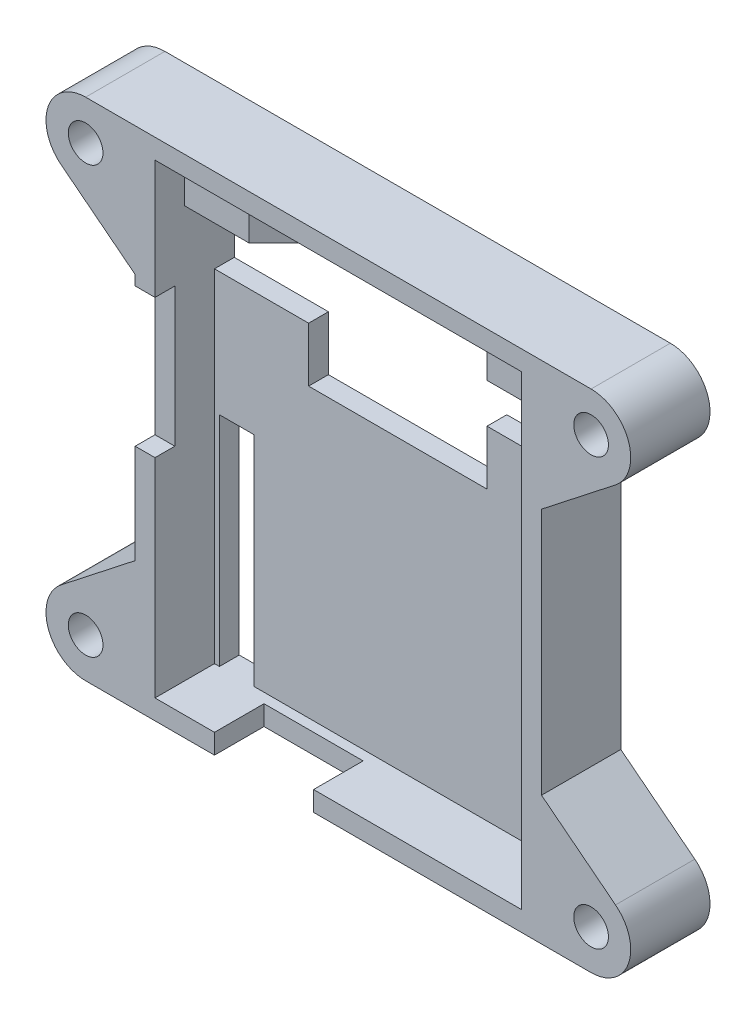
from build123d import *

# Parameters (mm, degrees)
SKETCH1_W                                  = 41
SKETCH1_H                                  = 51
BOSS_EXTRUDE1_DEPTH                        = 8
SHELL1_T                                   = -2
CUT_EXTRUDE1_DEPTH                         = 34.264094757
SKETCH3_W                                  = 10
SKETCH3_H                                  = 5
CUT_EXTRUDE2_DEPTH                         = 7
SKETCH4_W                                  = 2
SKETCH4_H                                  = 14
CUT_EXTRUDE3_DEPTH                         = 7
SKETCH5_W                                  = 3.5
SKETCH5_H                                  = 22
CUT_EXTRUDE4_DEPTH                         = 7
SKETCH6_R                                  = 1.75
BOSS_EXTRUDE2_DEPTH                        = 8
MIRROR1_AT_THE_SECOND_PLANE_COPY_1_SKETC_R = 1.75
MIRROR1_AT_THE_SECOND_PLANE_COPY_1_DEPTH   = 8
SKETCH7_W                                  = 9.5
SKETCH7_H                                  = 5.5
BOSS_EXTRUDE3_DEPTH                        = 3
CHAMFER1_SIZE                              = 3


with BuildPart() as part:
    # Sketch1 → Boss-Extrude1 (new body)
    with BuildSketch(Plane.XY):
        Rectangle(SKETCH1_W, SKETCH1_H)
    extrude(amount=BOSS_EXTRUDE1_DEPTH)

    # Shell1
    shell1_openings = [part.faces().sort_by_distance(p)[0] for p in [
        (0, 0, 8),
    ]]
    offset(amount=SHELL1_T, openings=shell1_openings, kind=Kind.INTERSECTION)

    # Sketch2 → Cut-Extrude1 (cut, through all)
    with BuildSketch(Plane.XY.offset(2)):
        Polygon((-9, 23.5), (9, 23.5), (9, 18), (18.5, 18), (18.5, 11), (9, 11), (9, 5.5), (-9, 5.5), (-9, 11), (-18.5, 11), (-18.5, 18), (-9, 18), align=None)
    extrude(amount=-CUT_EXTRUDE1_DEPTH, mode=Mode.SUBTRACT)

    # Sketch3 → Cut-Extrude2 (cut)
    with BuildSketch(Plane.XZ.offset(25.5)):
        with Locations((-7.5, 5.5)):
            Rectangle(SKETCH3_W, SKETCH3_H)
    extrude(amount=-CUT_EXTRUDE2_DEPTH, mode=Mode.SUBTRACT)

    # Sketch4 → Cut-Extrude3 (cut)
    with BuildSketch(Plane.ZY.offset(20.5)):
        with Locations((7, 4.5)):
            Rectangle(SKETCH4_W, SKETCH4_H)
    extrude(amount=-CUT_EXTRUDE3_DEPTH, mode=Mode.SUBTRACT)

    # Sketch5 → Cut-Extrude4 (cut)
    with BuildSketch(Plane(origin=(0, 0, 0), x_dir=(-1, 0, 0), z_dir=(0, 0, -1))):
        with Locations((-16.25, -12.5)):
            Rectangle(SKETCH5_W, SKETCH5_H)
        with Locations((16.25, -12.5)):
            Rectangle(SKETCH5_W, SKETCH5_H)
    extrude(amount=-CUT_EXTRUDE4_DEPTH, mode=Mode.SUBTRACT)

    # Sketch6 → Boss-Extrude2 (add)
    with BuildSketch(Plane.XY):
        with BuildLine():
            Line((25.5, 25.5), (20.5, 25.5))
            Line((20.5, 25.5), (20.5, 12.5))
            Line((20.5, 12.5), (27.967226295, 18.351540947))
            ThreePointArc((27.967226295, 18.351540947), (29.281126566, 22.805021798), (25.5, 25.5))
        make_face()
        with Locations((25.5, 21.5)):
            Circle(SKETCH6_R, mode=Mode.SUBTRACT)
    boss_extrude2 = extrude(amount=BOSS_EXTRUDE2_DEPTH)

    # Mirror1: Boss-Extrude2 across plane
    add(boss_extrude2.mirror(Plane(origin=(0, 0, 0), x_dir=(0, 0, 1), z_dir=(1, 0, 0))))

    # Mirror1 at the second plane: Boss-Extrude2 across plane
    add(boss_extrude2.mirror(Plane.ZX))

    # Mirror1 at the second plane copy 1 sketc → Mirror1 at the second plane copy 1 (add)
    with BuildSketch(Plane(origin=(0, 0, 0), x_dir=(-1, 0, 0), z_dir=(0, 0, 1))):
        with BuildLine():
            Line((25.5, 25.5), (20.5, 25.5))
            Line((20.5, 25.5), (20.5, 12.5))
            Line((20.5, 12.5), (27.967226295, 18.351540947))
            ThreePointArc((27.967226295, 18.351540947), (29.281126566, 22.805021798), (25.5, 25.5))
        make_face()
        with Locations((25.5, 21.5)):
            Circle(MIRROR1_AT_THE_SECOND_PLANE_COPY_1_SKETC_R, mode=Mode.SUBTRACT)
    extrude(amount=MIRROR1_AT_THE_SECOND_PLANE_COPY_1_DEPTH)

    # Sketch7 → Boss-Extrude3 (add)
    with BuildSketch(Plane.XY.offset(2)):
        with Locations((-13.75, 20.75)):
            Rectangle(SKETCH7_W, SKETCH7_H)
        with Locations((13.75, 20.75)):
            Rectangle(SKETCH7_W, SKETCH7_H)
    extrude(amount=BOSS_EXTRUDE3_DEPTH)

    # Chamfer1
    chamfer1_edges = [part.edges().sort_by_distance(p)[0] for p in [
        (-9, 20.75, 5),
        (9, 20.75, 5),
    ]]
    chamfer(chamfer1_edges, length=CHAMFER1_SIZE)


solid = part.part
